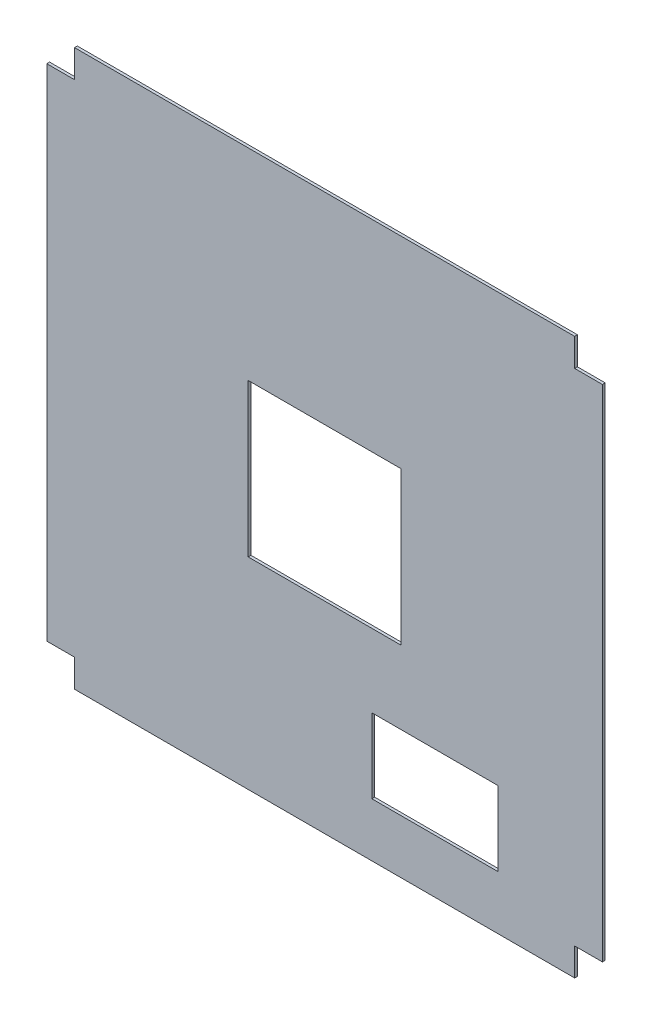
from build123d import *

# Parameters (mm, degrees)
EXTRUDE_1_DEPTH     = 2
SKETCH_2_W          = 110
SKETCH_2_H          = 110
CUT_EXTRUDE_1_DEPTH = 2
SKETCH_3_W          = 90.735858575
SKETCH_3_H          = 53.616643703
CUT_EXTRUDE_2_DEPTH = 75


with BuildPart() as part:
    # 草图1 → 凸台-拉伸1 (new body)
    with BuildSketch(Plane.XY):
        Polygon((10.000000001, 380), (370.000000001, 380), (370.000000001, 360), (390.000000001, 360), (390.000000001, 0), (370.000000001, 0), (370.000000001, -20), (10.000000001, -20), (10.000000001, 0), (-9.999999999, 0), (-9.999999999, 360), (10.000000001, 360), align=None)
    extrude(amount=EXTRUDE_1_DEPTH)

    # 草图2 → 切除-拉伸1 (cut)
    with BuildSketch(Plane.XY.offset(2)):
        with Locations((189.999999924, 180)):
            Rectangle(SKETCH_2_W, SKETCH_2_H)
    extrude(amount=-CUT_EXTRUDE_1_DEPTH, mode=Mode.SUBTRACT)

    # 草图3 → 切除-拉伸2 (cut)
    with BuildSketch(Plane.XY.offset(2)):
        with Locations((269.393876178, 45.545798569)):
            Rectangle(SKETCH_3_W, SKETCH_3_H)
    extrude(amount=-CUT_EXTRUDE_2_DEPTH, mode=Mode.SUBTRACT)


solid = part.part
